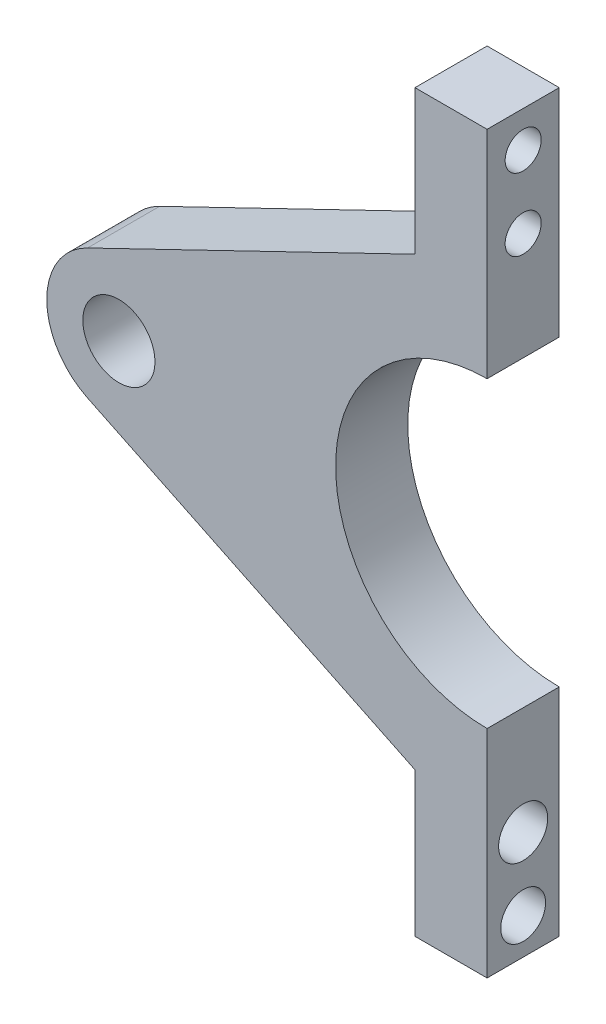
from build123d import *

# Parameters (mm, degrees)
BOSS_EXTRUDE2_DEPTH = 10
SKETCH2_R           = 5
CUT_EXTRUDE1_DEPTH  = 192.271419748
SKETCH3_R           = 2.5
SKETCH3_R_2         = 3.112586519
SKETCH3_R_3         = 3.406605284
CUT_EXTRUDE2_DEPTH  = 83.27950738


with BuildPart() as part:
    # Sketch1 → Boss-Extrude2 (new body)
    with BuildSketch(Plane.XY):
        with BuildLine():
            Line((-122.095943171, 24.299679487), (-122.095943171, 54.25))
            Line((-122.095943171, 54.25), (-132.095943171, 54.25))
            Line((-132.095943171, 54.25), (-132.095943171, 34.25))
            Line((-132.095943171, 34.25), (-177.496190175, 12.302884399))
            ThreePointArc((-177.496190175, 12.302884399), (-183.143914757, 3.299679487), (-177.496190175, -5.703525425))
            Line((-177.496190175, -5.703525425), (-132.095943171, -27.650641026))
            Line((-132.095943171, -27.650641026), (-132.095943171, -47.650641026))
            Line((-132.095943171, -47.650641026), (-122.095943171, -47.650641026))
            Line((-122.095943171, -47.650641026), (-122.095943171, -17.700320513))
            ThreePointArc((-122.095943171, -17.700320513), (-143.095943171, 3.299679487), (-122.095943171, 24.299679487))
        make_face()
    extrude(amount=-BOSS_EXTRUDE2_DEPTH)

    # Sketch2 → Cut-Extrude1 (cut, through all)
    with BuildSketch(Plane.XY):
        with Locations((-173.143914757, 3.299679487)):
            Circle(SKETCH2_R)
    extrude(amount=-CUT_EXTRUDE1_DEPTH, mode=Mode.SUBTRACT)

    # Sketch3 → Cut-Extrude2 (cut, through all)
    with BuildSketch(Plane(origin=(-122.095943171, 0, 0), x_dir=(0, 0, -1), z_dir=(1, 0, 0))):
        with Locations((5, 49.25)):
            Circle(SKETCH3_R)
        with Locations((5, 39.25)):
            Circle(SKETCH3_R)
        with Locations((5, -42.650641026)):
            Circle(SKETCH3_R_2)
        with Locations((5, -32.650641026)):
            Circle(SKETCH3_R_3)
    extrude(amount=-CUT_EXTRUDE2_DEPTH, mode=Mode.SUBTRACT)


solid = part.part
